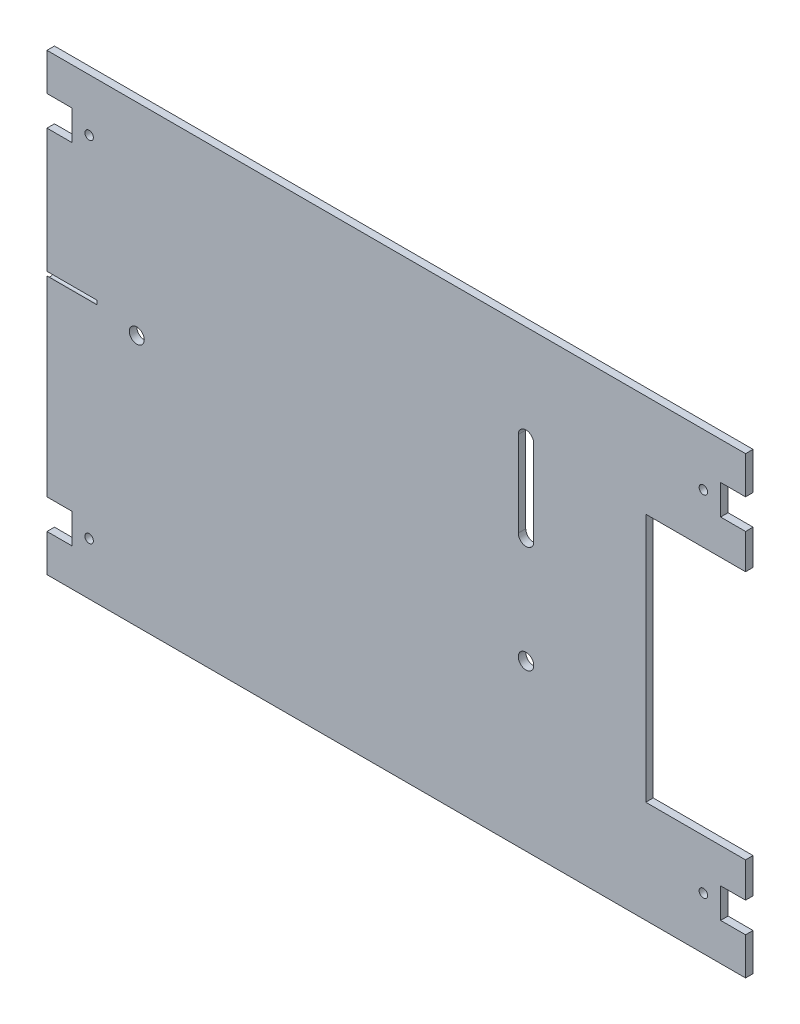
from build123d import *

# Parameters (mm, degrees)
BOSS_EXTRUDE1_DEPTH = 1.5
SKETCH3_R           = 1.5
SKETCH3_R_2         = 1.55
CUT_EXTRUDE1_DEPTH  = 1.5
SKETCH10_W          = 5
SKETCH10_H          = 6
SKETCH10_R          = 0.85
CUT_EXTRUDE5_DEPTH  = 167.982783544
SKETCH8_R           = 0.85
CUT_EXTRUDE4_DEPTH  = 10


with BuildPart() as part:
    # Sketch1 → Boss-Extrude1 (new body)
    with BuildSketch(Plane.XY):
        Polygon((140, 0), (0, 0), (0, -91), (140, -91), (140, -70.5), (120, -70.5), (120, -20.5), (140, -20.5), align=None)
    extrude(amount=BOSS_EXTRUDE1_DEPTH)

    # Sketch3 → Cut-Extrude1 (cut)
    with BuildSketch(Plane.XY.offset(1.5)):
        with Locations((18, -40.5)):
            Circle(SKETCH3_R)
        with Locations((96, -58)):
            Circle(SKETCH3_R_2)
        with BuildLine():
            Line((97.55, -19.439908336), (97.55, -36.560091664))
            ThreePointArc((97.55, -36.560091664), (96, -38.110091664), (94.45, -36.560091664))
            Line((94.45, -36.560091664), (94.45, -19.439908336))
            ThreePointArc((94.45, -19.439908336), (96, -17.889908336), (97.55, -19.439908336))
        make_face()
    extrude(amount=-CUT_EXTRUDE1_DEPTH, mode=Mode.SUBTRACT)

    # Sketch10 → Cut-Extrude5 (cut, through all)
    with BuildSketch(Plane.XY.offset(1.5)):
        with Locations((2.5, -10.5)):
            Rectangle(SKETCH10_W, SKETCH10_H)
        with Locations((2.5, -80.5)):
            Rectangle(SKETCH10_W, SKETCH10_H)
        with Locations((137.5, -10.5)):
            Rectangle(SKETCH10_W, SKETCH10_H)
        with Locations((137.5, -80.5)):
            Rectangle(SKETCH10_W, SKETCH10_H)
        with Locations((8.45, -10.5)):
            Circle(SKETCH10_R)
        with Locations((8.45, -80.5)):
            Circle(SKETCH10_R)
        with Locations((131.55, -10.5)):
            Circle(SKETCH10_R)
        with Locations((131.55, -80.5)):
            Circle(SKETCH10_R)
    extrude(amount=-CUT_EXTRUDE5_DEPTH, mode=Mode.SUBTRACT)

    # Sketch8 → Cut-Extrude4 (cut)
    with BuildSketch(Plane.ZY):
        with Locations((0.75, -38.75)):
            Circle(SKETCH8_R)
        with Locations((0.75, 31.25)):
            Circle(SKETCH8_R)
    extrude(amount=-CUT_EXTRUDE4_DEPTH, mode=Mode.SUBTRACT)


solid = part.part
